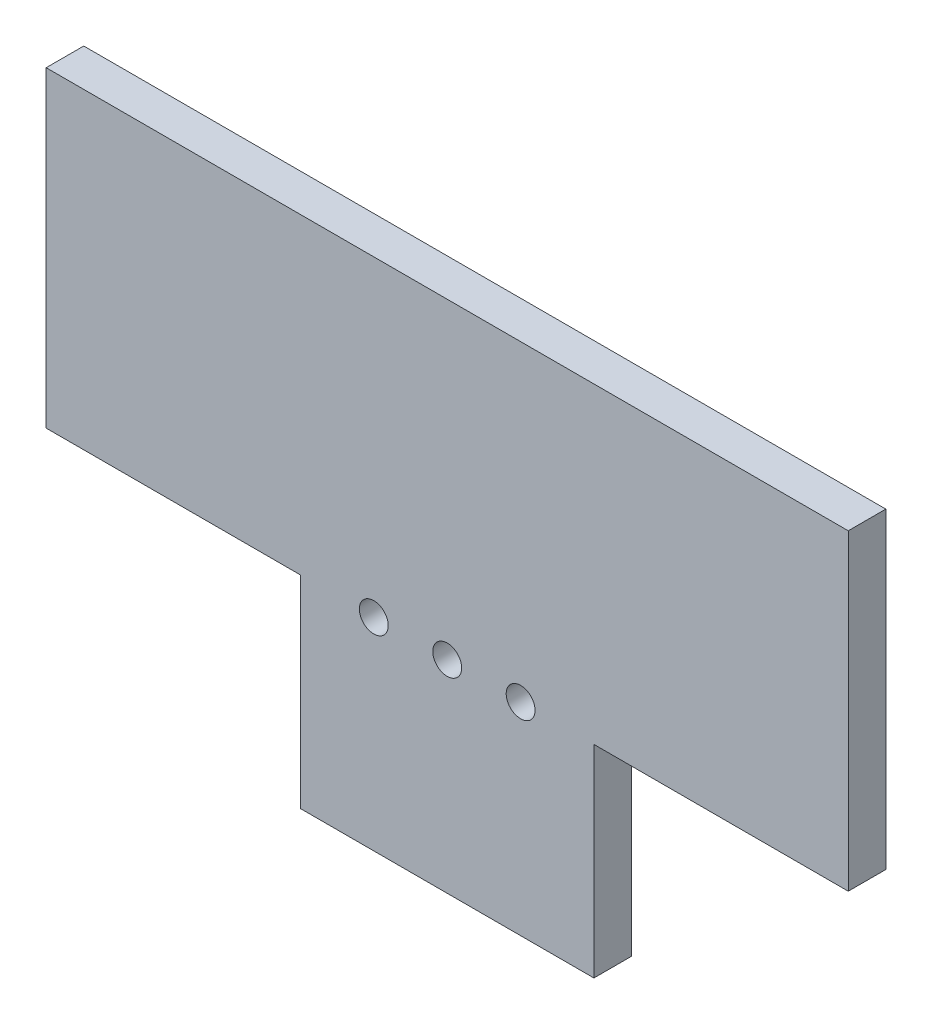
from build123d import *

# Parameters (mm, degrees)
EXTRUDE1_DEPTH     = 0.65
CUT_EXTRUDE1_REACH = 20.654
SKETCH3_R          = 0.5
LPATTERN1_COUNT    = 3
LPATTERN1_PITCH    = 2.54


with BuildPart() as part:
    # Sketch1 → Extrude1 (new, symmetric)
    with BuildSketch(Plane.XY):
        Polygon((5.075, -12.4), (5.075, -5.4), (13.875, -5.4), (13.875, 5.4), (-13.875, 5.4), (-13.875, -5.4), (-5.075, -5.4), (-5.075, -12.4), align=None)
    extrude(amount=EXTRUDE1_DEPTH, both=True)

    # Sketch3 → Cut-Extrude1 (cut, up to next)
    with BuildSketch(Plane.XY.offset(0.65), mode=Mode.PRIVATE) as cut_extrude1_sk1:
        with Locations((2.54, -5.4)):
            Circle(SKETCH3_R)
    cut_extrude1_tool1 = extrude(cut_extrude1_sk1.sketch, amount=-CUT_EXTRUDE1_REACH, mode=Mode.PRIVATE) & part.part
    cut_extrude1 = cut_extrude1_tool1.solids().sort_by_distance((2.54, -5.4, 0.65))[0]
    add(cut_extrude1, mode=Mode.SUBTRACT)

    # LPattern1: Cut-Extrude1 ×3
    with Locations(*[(-i * LPATTERN1_PITCH, 0, 0) for i in range(1, LPATTERN1_COUNT)]):
        add(cut_extrude1, mode=Mode.SUBTRACT)


solid = part.part
